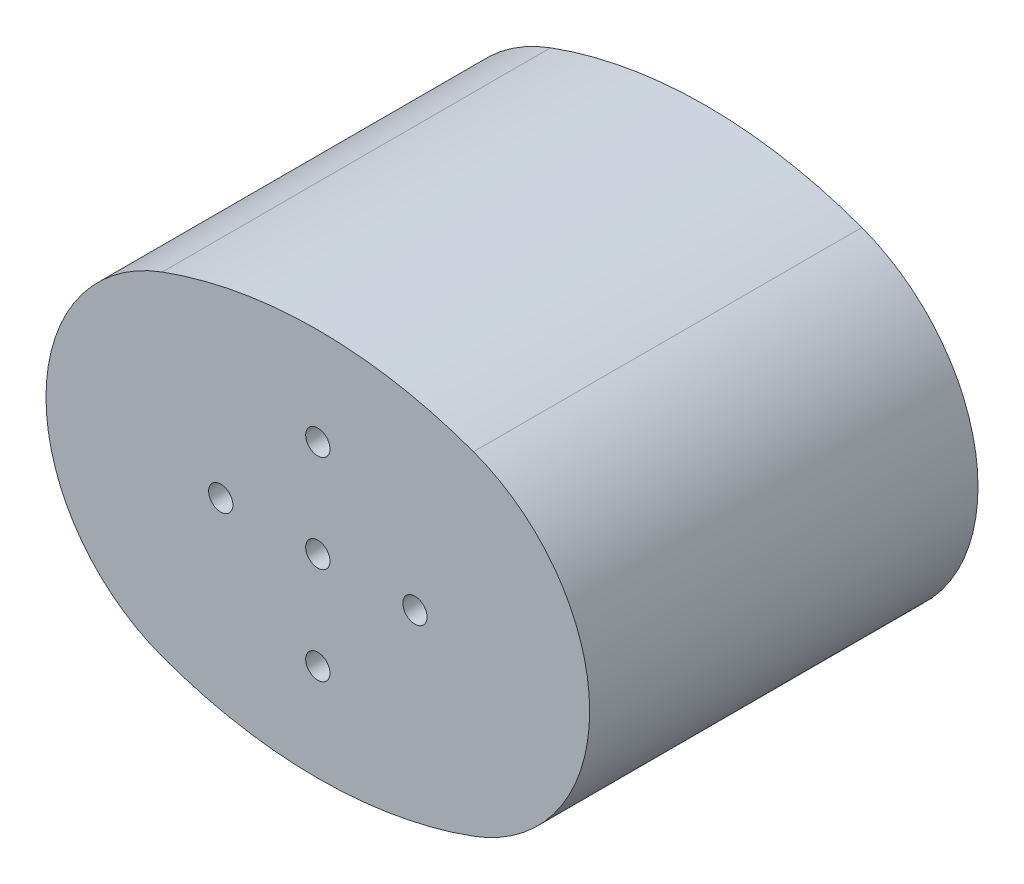
from build123d import *

# Parameters (mm, degrees)
BOSS_EXTRUDE1_DEPTH = 40
SKETCH2_R           = 1.25
CUT_EXTRUDE1_DEPTH  = 53.763623833


with BuildPart() as part:
    # Sketch1 → Boss-Extrude1 (new body)
    with BuildSketch(Plane.XY):
        with BuildLine():
            ThreePointArc((-16.03038595, 17.148754429), (-28, 0), (-16.03038595, -17.148754429))
            ThreePointArc((-16.03038595, -17.148754429), (0, -20), (16.03038595, -17.148754429))
            ThreePointArc((16.03038595, -17.148754429), (28, 0), (16.03038595, 17.148754429))
            ThreePointArc((16.03038595, 17.148754429), (0, 20), (-16.03038595, 17.148754429))
        make_face()
    extrude(amount=BOSS_EXTRUDE1_DEPTH)

    # Sketch2 → Cut-Extrude1 (cut, through all)
    with BuildSketch(Plane.XY.offset(40)):
        with Locations((0, 10)):
            Circle(SKETCH2_R)
        with Locations((10, 0)):
            Circle(SKETCH2_R)
        with Locations((0, -10)):
            Circle(SKETCH2_R)
        with Locations((-10, 0)):
            Circle(SKETCH2_R)
        Circle(SKETCH2_R)
    extrude(amount=-CUT_EXTRUDE1_DEPTH, mode=Mode.SUBTRACT)


solid = part.part
